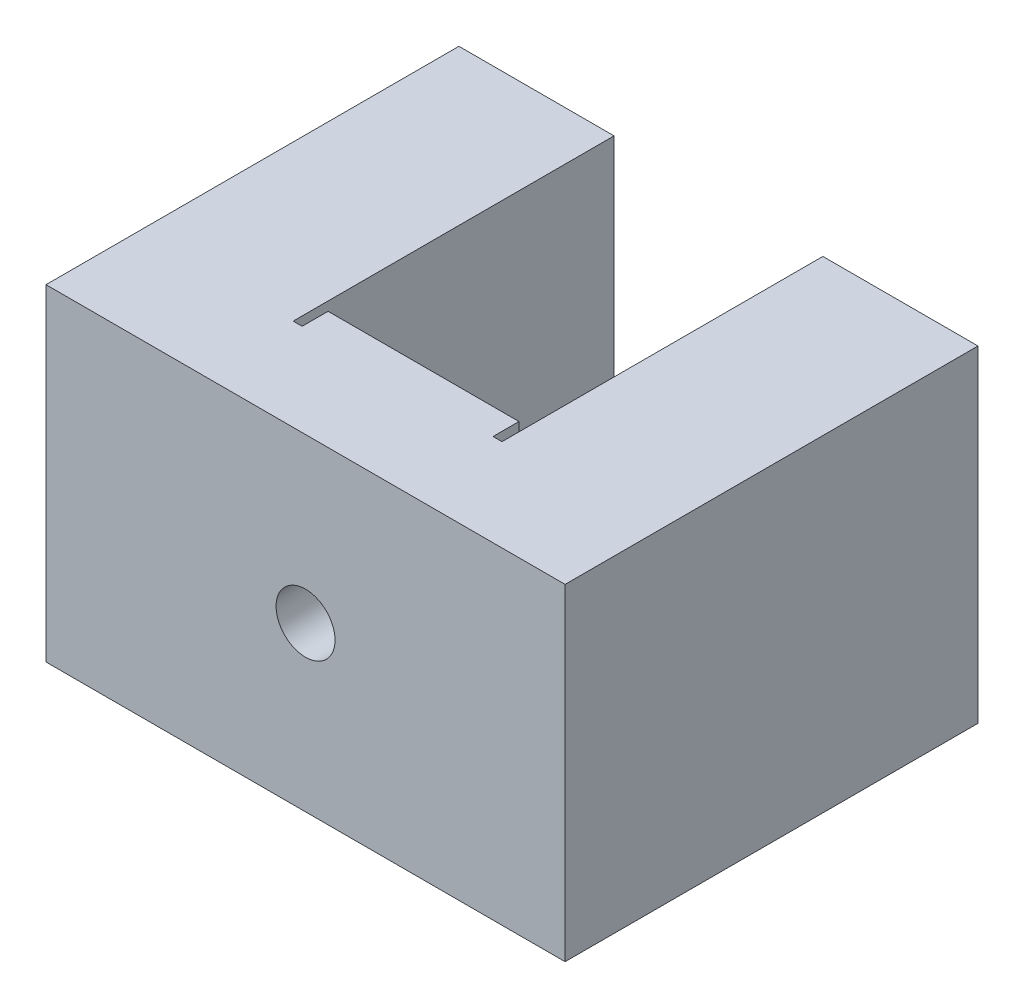
from build123d import *

# Parameters (mm, degrees)
SKETCH1_W           = 44
SKETCH1_H           = 27.7
BOSS_EXTRUDE1_DEPTH = 10
SKETCH2_W           = 13.15
SKETCH2_H           = 27.7
BOSS_EXTRUDE2_DEPTH = 25
SKETCH3_R           = 2.5
CUT_EXTRUDE1_DEPTH  = 10
SKETCH4_W           = 0.76
SKETCH4_H           = 27.7
CUT_EXTRUDE2_DEPTH  = 2.2


with BuildPart() as part:
    # Sketch1 → Boss-Extrude1 (new body)
    with BuildSketch(Plane.XY):
        Rectangle(SKETCH1_W, SKETCH1_H)
    extrude(amount=BOSS_EXTRUDE1_DEPTH)

    # Sketch2 → Boss-Extrude2 (add)
    with BuildSketch(Plane(origin=(0, 0, 0), x_dir=(-1, 0, 0), z_dir=(0, 0, -1))):
        with Locations((-15.425, 0)):
            Rectangle(SKETCH2_W, SKETCH2_H)
        with Locations((15.425, 0)):
            Rectangle(SKETCH2_W, SKETCH2_H)
    extrude(amount=BOSS_EXTRUDE2_DEPTH)

    # Sketch3 → Cut-Extrude1 (cut)
    with BuildSketch(Plane.XY.offset(10)):
        Circle(SKETCH3_R)
    extrude(amount=-CUT_EXTRUDE1_DEPTH, mode=Mode.SUBTRACT)

    # Sketch4 → Cut-Extrude2 (cut)
    with BuildSketch(Plane(origin=(0, 0, 0), x_dir=(-1, 0, 0), z_dir=(0, 0, -1))):
        with Locations((-8.47, 0)):
            Rectangle(SKETCH4_W, SKETCH4_H)
        with Locations((8.47, 0)):
            Rectangle(SKETCH4_W, SKETCH4_H)
    extrude(amount=-CUT_EXTRUDE2_DEPTH, mode=Mode.SUBTRACT)


solid = part.part
